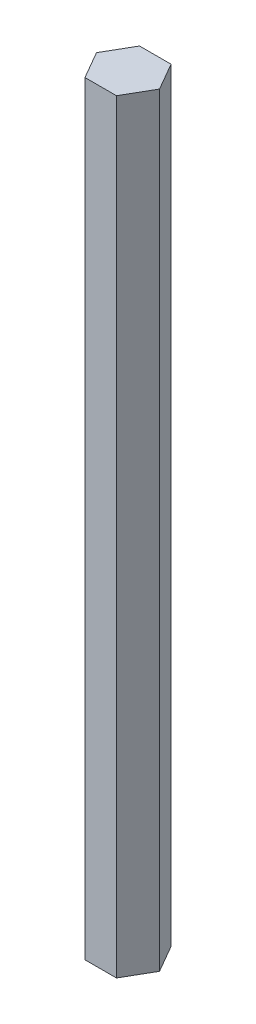
from build123d import *

# Parameters (mm, degrees)
BOSS_EXTRUDE1_DEPTH = 177.8


with BuildPart() as part:
    # Sketch1 → Boss-Extrude1 (new body)
    with BuildSketch(Plane(origin=(0, 0, 0), x_dir=(1, 0, 0), z_dir=(0, 1, 0))):
        Polygon((7.332348419, 0), (3.666174209, 6.35), (-3.666174209, 6.35), (-7.332348419, 0), (-3.666174209, -6.35), (3.666174209, -6.35), align=None)
    extrude(amount=BOSS_EXTRUDE1_DEPTH)


solid = part.part
